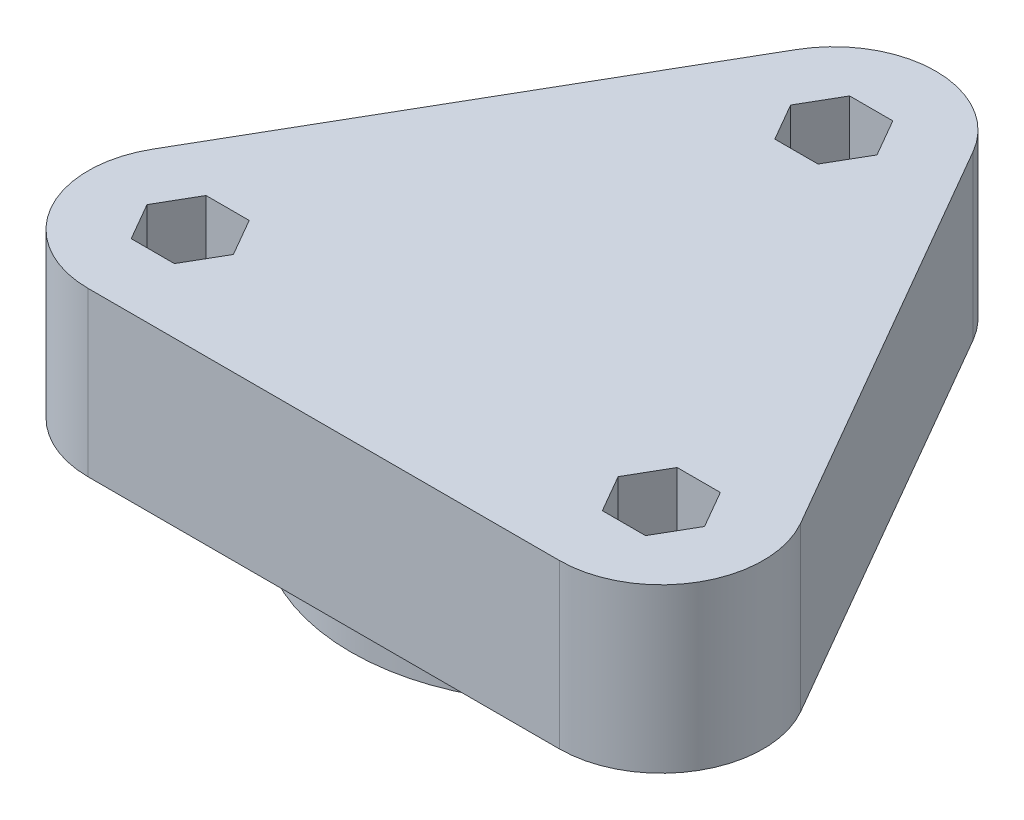
from build123d import *

# Parameters (mm, degrees)
ESQUISSE1_R             = 11.9
ESQUISSE1_R_2           = 1.6
BOSS_EXTRU_1_DEPTH      = 12
ENL_V_MAT_EXTRU_1_DEPTH = 5
BOSS_EXTRUDE1_START     = -3.5
SKETCH1_R               = 11.9
BOSS_EXTRUDE1_DEPTH     = 3.5
BOSS_EXTRUDE2_START     = 3.5
SKETCH2_R               = 15.5
SKETCH2_R_2             = 11.9
BOSS_EXTRUDE2_DEPTH     = 3.5


with BuildPart() as part:
    # Esquisse1 → Boss.-Extru.1 (new body)
    with BuildSketch(Plane(origin=(0, 0, 0), x_dir=(1, 0, 0), z_dir=(0, 1, 0))):
        with BuildLine():
            Line((-6.495190528, 23.75), (-23.815698604, -6.25))
            ThreePointArc((-23.815698604, -6.25), (-23.815698604, -13.75), (-17.320508076, -17.5))
            Line((-17.320508076, -17.5), (17.320508076, -17.5))
            ThreePointArc((17.320508076, -17.5), (23.815698604, -13.75), (23.815698604, -6.25))
            Line((23.815698604, -6.25), (6.495190528, 23.75))
            ThreePointArc((6.495190528, 23.75), (0, 27.5), (-6.495190528, 23.75))
        make_face()
        with Locations(Location((0, 0, 0), (0, 0, 270))):
            Circle(ESQUISSE1_R, mode=Mode.SUBTRACT)
        with Locations(Location((-17.320508076, -10, 0), (0, 0, 270))):
            Circle(ESQUISSE1_R_2, mode=Mode.SUBTRACT)
        with Locations(Location((0, 20, 0), (0, 0, 270))):
            Circle(ESQUISSE1_R_2, mode=Mode.SUBTRACT)
        with Locations(Location((17.320508076, -10, 0), (0, 0, 270))):
            Circle(ESQUISSE1_R_2, mode=Mode.SUBTRACT)
    extrude(amount=BOSS_EXTRU_1_DEPTH)

    # Esquisse2 → Enlèv. mat.-Extru.1 (cut)
    with BuildSketch(Plane(origin=(0, 12, 0), x_dir=(1, 0, 0), z_dir=(0, 1, 0))):
        Polygon((-18.908221316, -7.25), (-20.495934556, -10), (-18.908221316, -12.75), (-15.732794835, -12.75), (-14.145081595, -10), (-15.732794835, -7.25), align=None)
        Polygon((-1.58771324, 22.75), (-3.175426481, 20), (-1.58771324, 17.25), (1.58771324, 17.25), (3.175426481, 20), (1.58771324, 22.75), align=None)
        Polygon((18.908221316, -7.25), (15.732794835, -7.25), (14.145081595, -10), (15.732794835, -12.75), (18.908221316, -12.75), (20.495934556, -10), align=None)
    extrude(amount=-ENL_V_MAT_EXTRU_1_DEPTH, mode=Mode.SUBTRACT)

    # Sketch1 → Boss-Extrude1 (add)
    with BuildSketch(Plane(origin=(0, 12, 0), x_dir=(1, 0, 0), z_dir=(0, 1, 0)).offset(BOSS_EXTRUDE1_START)):
        with Locations(Location((0, 0, 0), (0, 0, 270))):
            Circle(SKETCH1_R)
    extrude(amount=BOSS_EXTRUDE1_DEPTH)

    # Sketch2 → Boss-Extrude2 (add)
    with BuildSketch(Plane.XZ.offset(BOSS_EXTRUDE2_START)):
        with Locations(Location((0, 0, 0), (0, 0, 90))):
            Circle(SKETCH2_R)
        with Locations(Location((0, 0, 0), (0, 0, 270))):
            Circle(SKETCH2_R_2, mode=Mode.SUBTRACT)
    extrude(amount=-BOSS_EXTRUDE2_DEPTH)


solid = part.part
